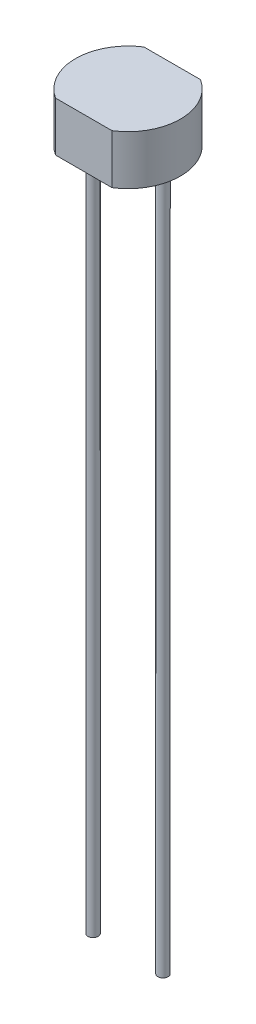
from build123d import *

# Parameters (mm, degrees)
BOSS_EXTRUDE1_DEPTH = 2.4
SKETCH2_R           = 0.25
BOSS_EXTRUDE2_DEPTH = 34


with BuildPart() as part:
    # Sketch1 → Boss-Extrude1 (new body)
    with BuildSketch(Plane(origin=(0, 0, 0), x_dir=(1, 0, 0), z_dir=(0, 1, 0))):
        with BuildLine():
            ThreePointArc((2.55, 0), (2.235943184, 1.22599269), (1.37113092, 2.15))
            Line((1.37113092, 2.15), (-1.37113092, 2.15))
            ThreePointArc((-1.37113092, 2.15), (-2.235943184, 1.22599269), (-2.55, 0))
            ThreePointArc((-2.55, 0), (-2.235943184, -1.22599269), (-1.37113092, -2.15))
            Line((-1.37113092, -2.15), (1.37113092, -2.15))
            ThreePointArc((1.37113092, -2.15), (2.235943184, -1.22599269), (2.55, 0))
        make_face()
    extrude(amount=BOSS_EXTRUDE1_DEPTH)

    # Sketch2 → Boss-Extrude2 (add)
    with BuildSketch(Plane.XZ):
        with Locations(Location((-1.7, 0, 0), (0, 0, 90))):
            Circle(SKETCH2_R)
        with Locations(Location((1.7, 0, 0), (0, 0, 90))):
            Circle(SKETCH2_R)
    extrude(amount=BOSS_EXTRUDE2_DEPTH)


solid = part.part
